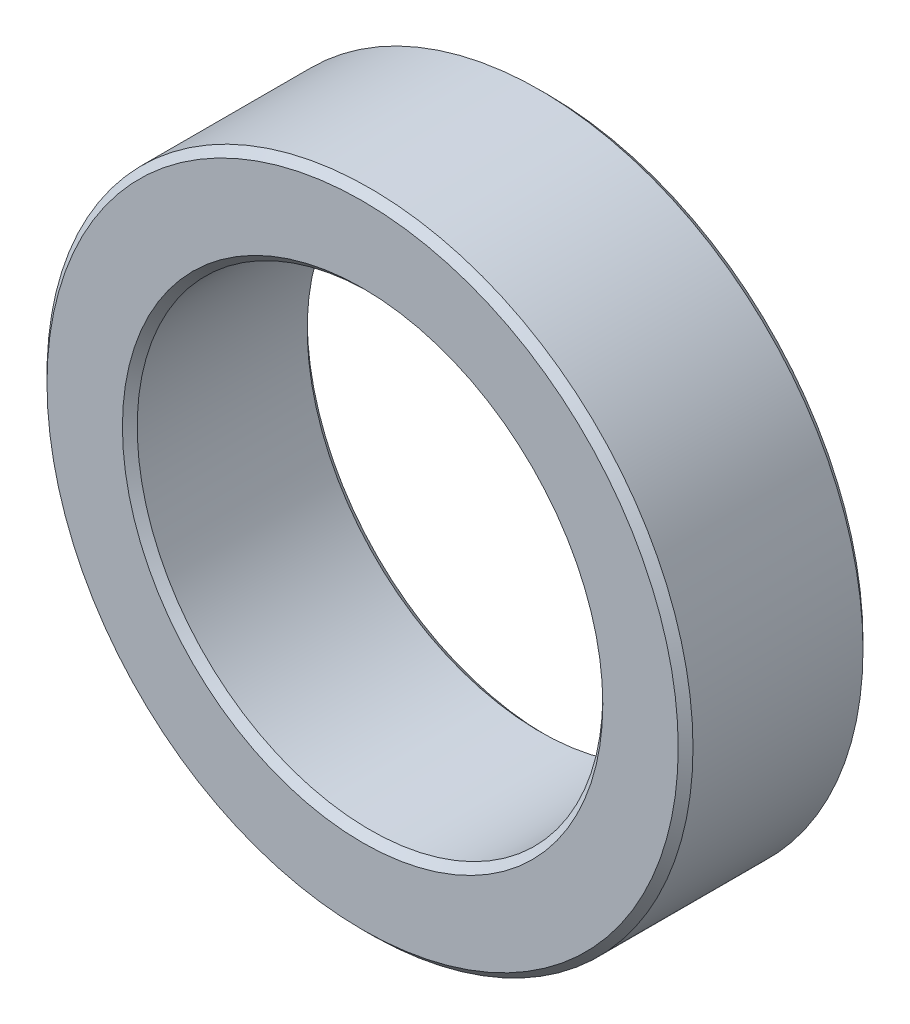
from build123d import *

# Parameters (mm, degrees)
SKETCH1_R           = 5.5499
SKETCH1_R_2         = 4.000000001
BOSS_EXTRUDE1_DEPTH = 3.175
CHAMFER1_SIZE       = 0.127


with BuildPart() as part:
    # Sketch1 → Boss-Extrude1 (new body)
    with BuildSketch(Plane.XY):
        Circle(SKETCH1_R)
        Circle(SKETCH1_R_2, mode=Mode.SUBTRACT)
    extrude(amount=BOSS_EXTRUDE1_DEPTH)

    # Chamfer1
    chamfer1_edges = [part.edges().sort_by_distance(p)[0] for p in [
        (-5.5499, 0, 0),
        (-5.5499, 0, 3.175),
        (-4.000000001, 0, 0),
        (-4.000000001, 0, 3.175),
    ]]
    chamfer(chamfer1_edges, length=CHAMFER1_SIZE)


solid = part.part
